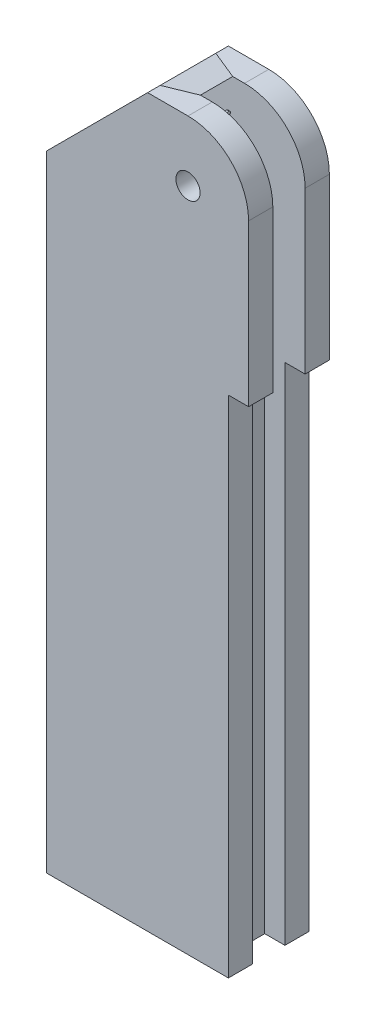
from build123d import *

# Parameters (mm, degrees)
EXTRUSION1_DEPTH        = 10
EXTRUSION1_DEPTH_BACK   = 10
ESQUISSE1_R             = 3
ESQUISSE2_W             = 8
ESQUISSE2_H             = 38.994969405
ENL_V_MAT_EXTRU_2_DEPTH = 173.555853277
CHANFREIN1_SIZE         = 5
CHANFREIN1_SIZE2        = 2.886751346
CHANFREIN1_PART_2_SIZE  = 5
CHANFREIN1_PART_2_SIZE2 = 2.886751346
ESQUISSE3_W             = 10.585305106
ESQUISSE3_H             = 8
ENL_V_MAT_EXTRU_3_DEPTH = 155.207725163
ESQUISSE4_R             = 0.5
EXTRUSION2_DEPTH        = 0.5


with BuildPart() as part:
    # Esquisse1 → Extrusion1 (new, two sides: drawn at the far end of the back side and taken through both)
    with BuildSketch(Plane.XY.offset(-EXTRUSION1_DEPTH_BACK)):
        with BuildLine():
            Line((-35, -10), (-10, 15))
            Line((-10, 15), (0, 15))
            ThreePointArc((0, 15), (10.606601718, 10.606601718), (15, 0))
            Line((15, 0), (15, -39.85))
            Line((15, -39.85), (10, -39.85))
            Line((10, -39.85), (10, -164.85))
            Line((10, -164.85), (-35, -164.85))
            Line((-35, -164.85), (-35, -10))
        make_face()
        Circle(ESQUISSE1_R, mode=Mode.SUBTRACT)
    extrude(amount=EXTRUSION1_DEPTH + EXTRUSION1_DEPTH_BACK)

    # Esquisse2 → Enlèv. mat.-Extru.2 (cut, through all)
    with BuildSketch(Plane(origin=(15, 0, 0), x_dir=(0, 0, -1), z_dir=(1, 0, 0))):
        with Locations((0, 4.497484703)):
            Rectangle(ESQUISSE2_W, ESQUISSE2_H)
    extrude(amount=-ENL_V_MAT_EXTRU_2_DEPTH, mode=Mode.SUBTRACT)

    # Chanfrein1
    chanfrein1_edges = [part.edges().sort_by_distance(p)[0] for p in [
        (-22.5, 2.5, 4),
    ]]
    chanfrein1_side = [part.faces().sort_by_distance(p)[0] for p in [
        (-6.507250636, -2.381616227, 4),
    ]]
    chamfer(chanfrein1_edges, length=CHANFREIN1_SIZE, length2=CHANFREIN1_SIZE2, reference=chanfrein1_side[0])

    # Chanfrein1 part 2
    chanfrein1_part_2_edges = [part.edges().sort_by_distance(p)[0] for p in [
        (-22.5, 2.5, -4),
    ]]
    chanfrein1_part_2_side = [part.faces().sort_by_distance(p)[0] for p in [
        (-6.507250636, -2.381616227, -4),
    ]]
    chamfer(chanfrein1_part_2_edges, length=CHANFREIN1_PART_2_SIZE, length2=CHANFREIN1_PART_2_SIZE2, reference=chanfrein1_part_2_side[0])

    # Esquisse3 → Enlèv. mat.-Extru.3 (cut, through all)
    with BuildSketch(Plane(origin=(0, -15, 0), x_dir=(-1, 0, 0), z_dir=(0, 1, 0))):
        with Locations((-10.292652553, 0)):
            Rectangle(ESQUISSE3_W, ESQUISSE3_H)
    extrude(amount=-ENL_V_MAT_EXTRU_3_DEPTH, mode=Mode.SUBTRACT)


with BuildPart() as body_2:
    # Esquisse4 → Extrusion2 (new body)
    with BuildSketch(Plane(origin=(0, 0, 0), x_dir=(0, 0, -1), z_dir=(1, 0, 0))):
        with Locations((0, 10.5)):
            Circle(ESQUISSE4_R)
    extrude(amount=-EXTRUSION2_DEPTH)


solid = Compound([part.part, body_2.part])
